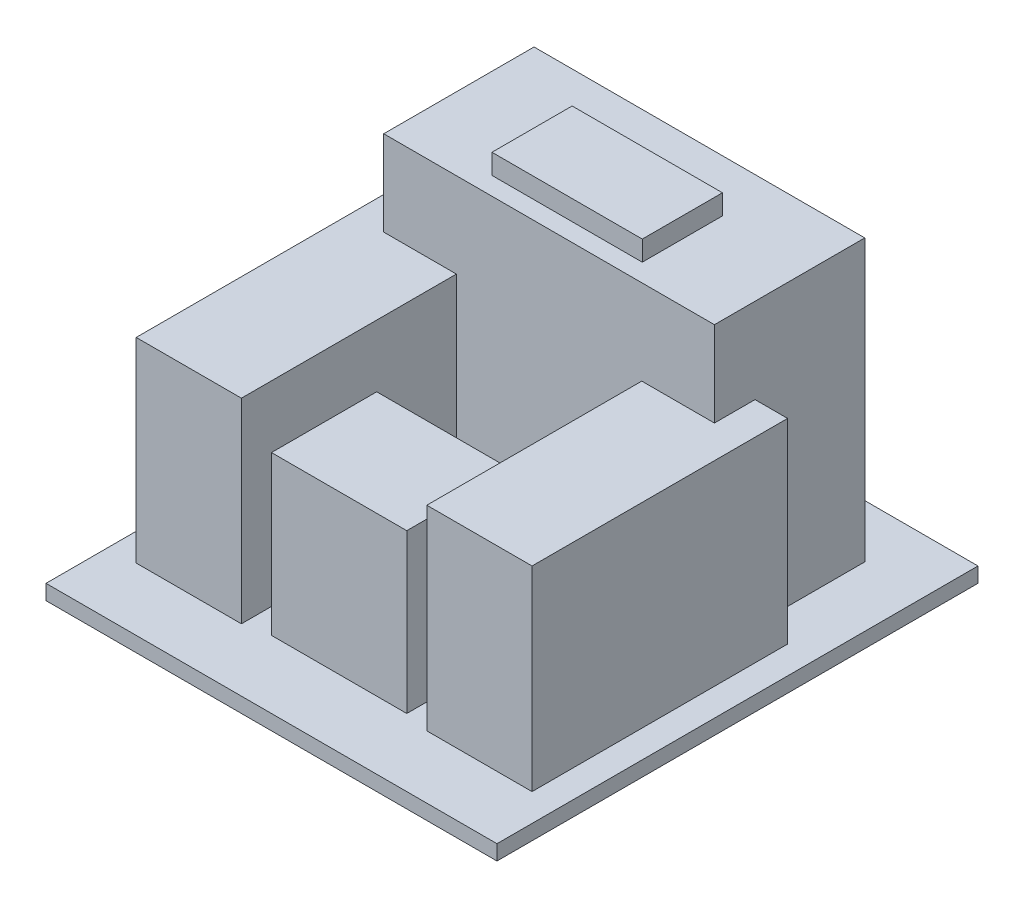
from build123d import *

# Parameters (mm, degrees)
SKETCH_1_W      = 450
SKETCH_1_H      = 480
EXTRUDE_1_DEPTH = 15
SKETCH_2_W      = 330
SKETCH_2_H      = 150
EXTRUDE_2_DEPTH = 280
SKETCH_3_W      = 105
SKETCH_3_H      = 255
EXTRUDE_3_DEPTH = 195
SKETCH_4_W      = 105
SKETCH_4_H      = 255
EXTRUDE_4_DEPTH = 195
SKETCH_5_W      = 135
SKETCH_5_H      = 105
EXTRUDE_5_DEPTH = 158
SKETCH_6_W      = 150
SKETCH_6_H      = 80
EXTRUDE_6_DEPTH = 300


with BuildPart() as part:
    # 草图1 → 凸台-拉伸1 (new body)
    with BuildSketch(Plane(origin=(0, 0, 0), x_dir=(1, 0, 0), z_dir=(0, 1, 0))):
        Rectangle(SKETCH_1_W, SKETCH_1_H)
    extrude(amount=-EXTRUDE_1_DEPTH)

    # 草图2 → 凸台-拉伸2 (add)
    with BuildSketch(Plane(origin=(0, 0, 0), x_dir=(1, 0, 0), z_dir=(0, 1, 0))):
        with Locations((0, 112)):
            Rectangle(SKETCH_2_W, SKETCH_2_H)
    extrude(amount=EXTRUDE_2_DEPTH)

    # 草图3 → 凸台-拉伸3 (add)
    with BuildSketch(Plane(origin=(0, 0, 0), x_dir=(1, 0, 0), z_dir=(0, 1, 0))):
        with Locations((-145, -50)):
            Rectangle(SKETCH_3_W, SKETCH_3_H)
    extrude(amount=EXTRUDE_3_DEPTH)

    # 草图4 → 凸台-拉伸4 (add)
    with BuildSketch(Plane(origin=(0, 0, 0), x_dir=(1, 0, 0), z_dir=(0, 1, 0))):
        with Locations((145, -50)):
            Rectangle(SKETCH_4_W, SKETCH_4_H)
    extrude(amount=EXTRUDE_4_DEPTH)

    # 草图5 → 凸台-拉伸5 (add)
    with BuildSketch(Plane(origin=(0, 0, 0), x_dir=(1, 0, 0), z_dir=(0, 1, 0))):
        with Locations((0, -120)):
            Rectangle(SKETCH_5_W, SKETCH_5_H)
    extrude(amount=EXTRUDE_5_DEPTH)

    # 草图6 → 凸台-拉伸6 (add)
    with BuildSketch(Plane(origin=(0, 0, 0), x_dir=(1, 0, 0), z_dir=(0, 1, 0))):
        with Locations((0, 95)):
            Rectangle(SKETCH_6_W, SKETCH_6_H)
    extrude(amount=EXTRUDE_6_DEPTH)


solid = part.part
